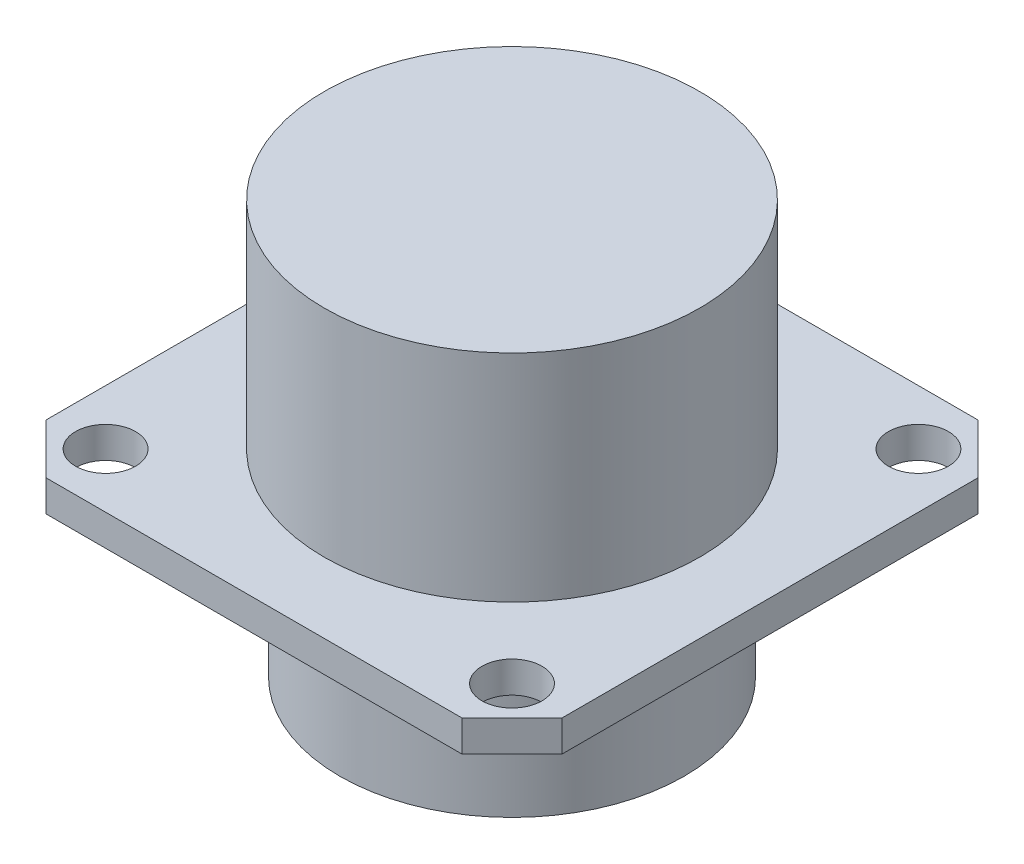
from build123d import *

# Parameters (mm, degrees)
SKETCH1_W           = 26.1874
SKETCH1_H           = 26.1874
BOSS_EXTRUDE1_DEPTH = 1.5875
CHAMFER1_SIZE       = 2.54
SKETCH2_R           = 1.524
CUT_EXTRUDE1_DEPTH  = 19.585212284
SKETCH3_R           = 9.525
BOSS_EXTRUDE2_DEPTH = 10.9474
SKETCH4_R           = 8.7376
BOSS_EXTRUDE3_DEPTH = 8.4328


with BuildPart() as part:
    # Sketch1 → Boss-Extrude1 (new body)
    with BuildSketch(Plane(origin=(0, 0, 0), x_dir=(1, 0, 0), z_dir=(0, 1, 0))):
        Rectangle(SKETCH1_W, SKETCH1_H)
    extrude(amount=BOSS_EXTRUDE1_DEPTH)

    # Chamfer1
    chamfer1_edges = [part.edges().sort_by_distance(p)[0] for p in [
        (13.0937, 0.79375, 13.0937),
        (-13.0937, 0.79375, 13.0937),
        (-13.0937, 0.79375, -13.0937),
        (13.0937, 0.79375, -13.0937),
    ]]
    chamfer(chamfer1_edges, length=CHAMFER1_SIZE)

    # Sketch2 → Cut-Extrude1 (cut, through all)
    with BuildSketch(Plane(origin=(0, 1.5875, 0), x_dir=(1, 0, 0), z_dir=(0, 1, 0))):
        with Locations(Location((-10.3124, 10.3124, 0), (0, 0, 270))):
            Circle(SKETCH2_R)
        with Locations(Location((10.3124, 10.3124, 0), (0, 0, 270))):
            Circle(SKETCH2_R)
        with Locations(Location((10.3124, -10.3124, 0), (0, 0, 270))):
            Circle(SKETCH2_R)
        with Locations(Location((-10.3124, -10.3124, 0), (0, 0, 270))):
            Circle(SKETCH2_R)
    extrude(amount=-CUT_EXTRUDE1_DEPTH, mode=Mode.SUBTRACT)

    # Sketch3 → Boss-Extrude2 (add)
    with BuildSketch(Plane(origin=(0, 1.5875, 0), x_dir=(1, 0, 0), z_dir=(0, 1, 0))):
        with Locations(Location((0, 0, 0), (0, 0, 270))):
            Circle(SKETCH3_R)
    extrude(amount=BOSS_EXTRUDE2_DEPTH)

    # Sketch4 → Boss-Extrude3 (add)
    with BuildSketch(Plane.XZ):
        with Locations(Location((0, 0, 0), (0, 0, 90))):
            Circle(SKETCH4_R)
    extrude(amount=BOSS_EXTRUDE3_DEPTH)


solid = part.part
